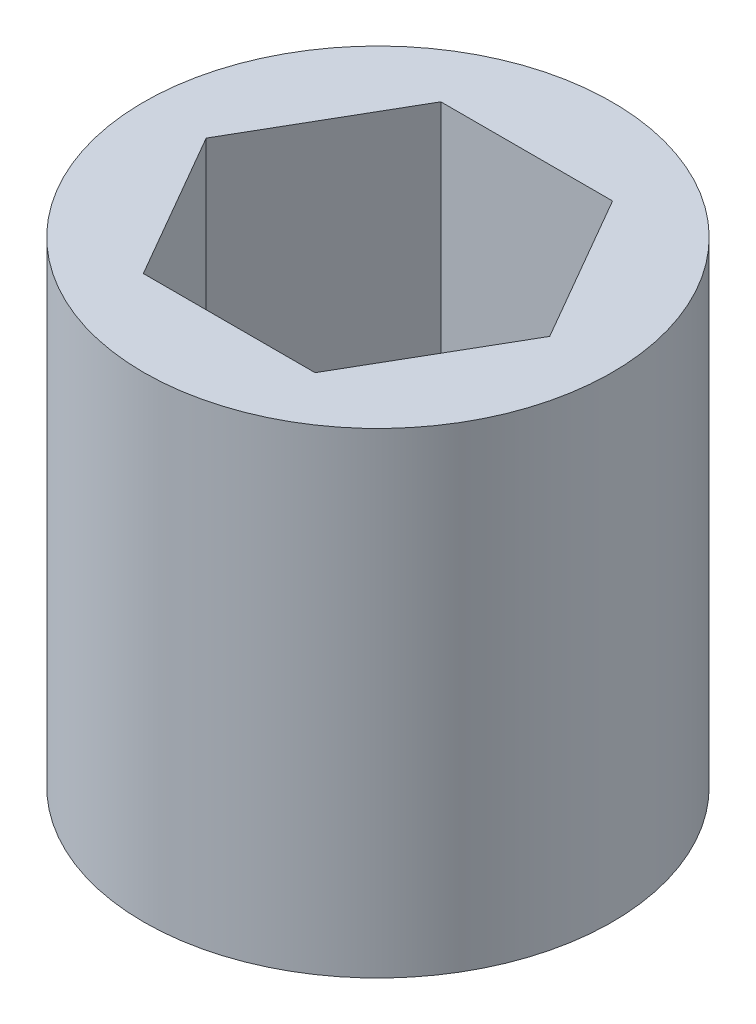
from build123d import *

# Parameters (mm, degrees)
SKETCH1_R           = 10
BOSS_EXTRUDE1_DEPTH = 20.32


with BuildPart() as part:
    # Sketch1 → Boss-Extrude1 (new body)
    with BuildSketch(Plane(origin=(0, 0, 0), x_dir=(1, 0, 0), z_dir=(0, 1, 0))):
        with Locations(Location((0, 0, 0), (0, 0, 270))):
            Circle(SKETCH1_R)
        Polygon((-7.332348419, 0), (-3.666174209, -6.35), (3.666174209, -6.35), (7.332348419, 0), (3.666174209, 6.35), (-3.666174209, 6.35), align=None, mode=Mode.SUBTRACT)
    extrude(amount=BOSS_EXTRUDE1_DEPTH)


solid = part.part
